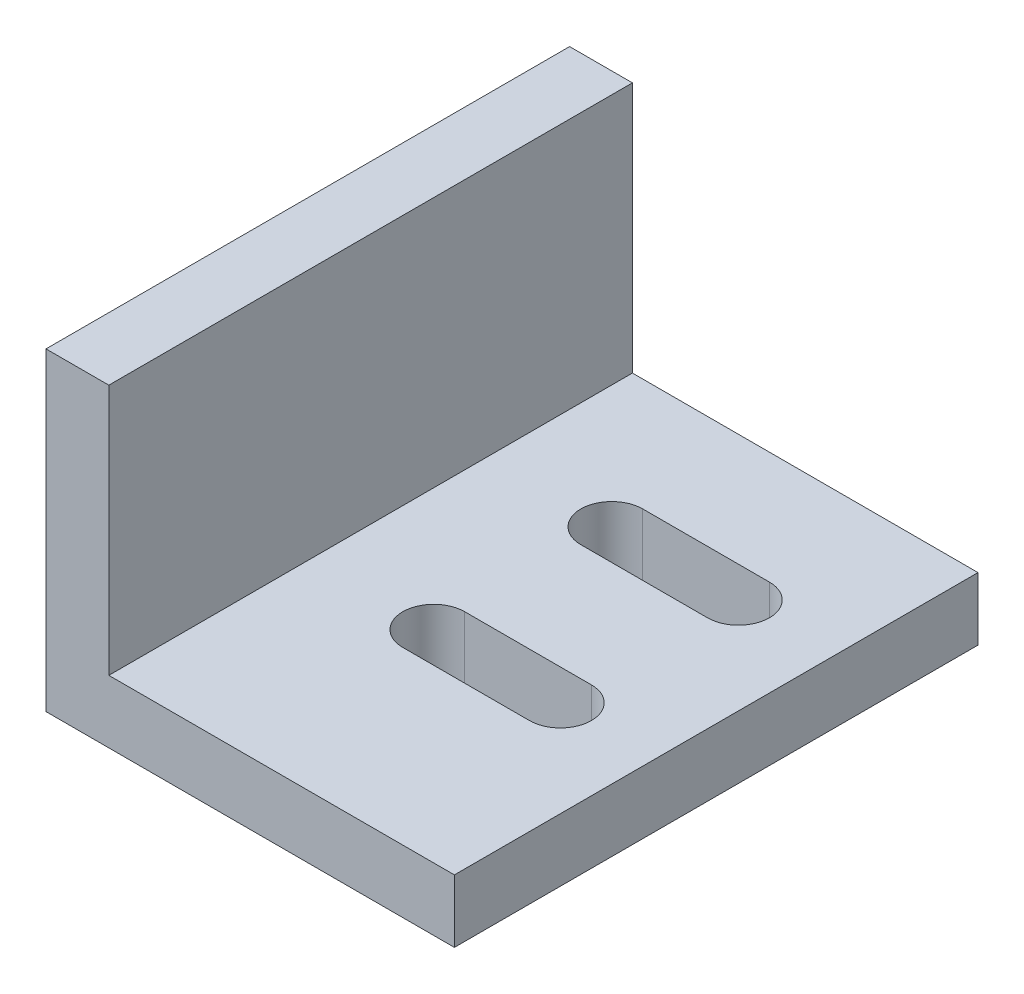
from build123d import *

# Parameters (mm, degrees)
BOSS_EXTRUDE1_DEPTH = 50
CUT_EXTRUDE1_DEPTH  = 14


with BuildPart() as part:
    # Sketch1 → Boss-Extrude1 (new body)
    with BuildSketch(Plane.XY):
        Polygon((0, 0), (-39, 0), (-39, 30), (-33, 30), (-33, 6), (0, 6), align=None)
    extrude(amount=BOSS_EXTRUDE1_DEPTH)

    # Sketch2 → Cut-Extrude1 (cut)
    with BuildSketch(Plane.XZ):
        with BuildLine():
            Line((-21.273396894, 33.65603272), (-9.173396894, 33.65603272))
            ThreePointArc((-9.173396894, 33.65603272), (-6.217364174, 30.7), (-9.173396894, 27.74396728))
            Line((-9.173396894, 27.74396728), (-21.273396894, 27.74396728))
            ThreePointArc((-21.273396894, 27.74396728), (-24.229429614, 30.7), (-21.273396894, 33.65603272))
        make_face()
        with BuildLine():
            Line((-21.273396894, 16.65603272), (-9.173396894, 16.65603272))
            ThreePointArc((-9.173396894, 16.65603272), (-6.217364174, 13.7), (-9.173396894, 10.74396728))
            Line((-9.173396894, 10.74396728), (-21.273396894, 10.74396728))
            ThreePointArc((-21.273396894, 10.74396728), (-24.229429614, 13.7), (-21.273396894, 16.65603272))
        make_face()
    extrude(amount=-CUT_EXTRUDE1_DEPTH, mode=Mode.SUBTRACT)


solid = part.part
